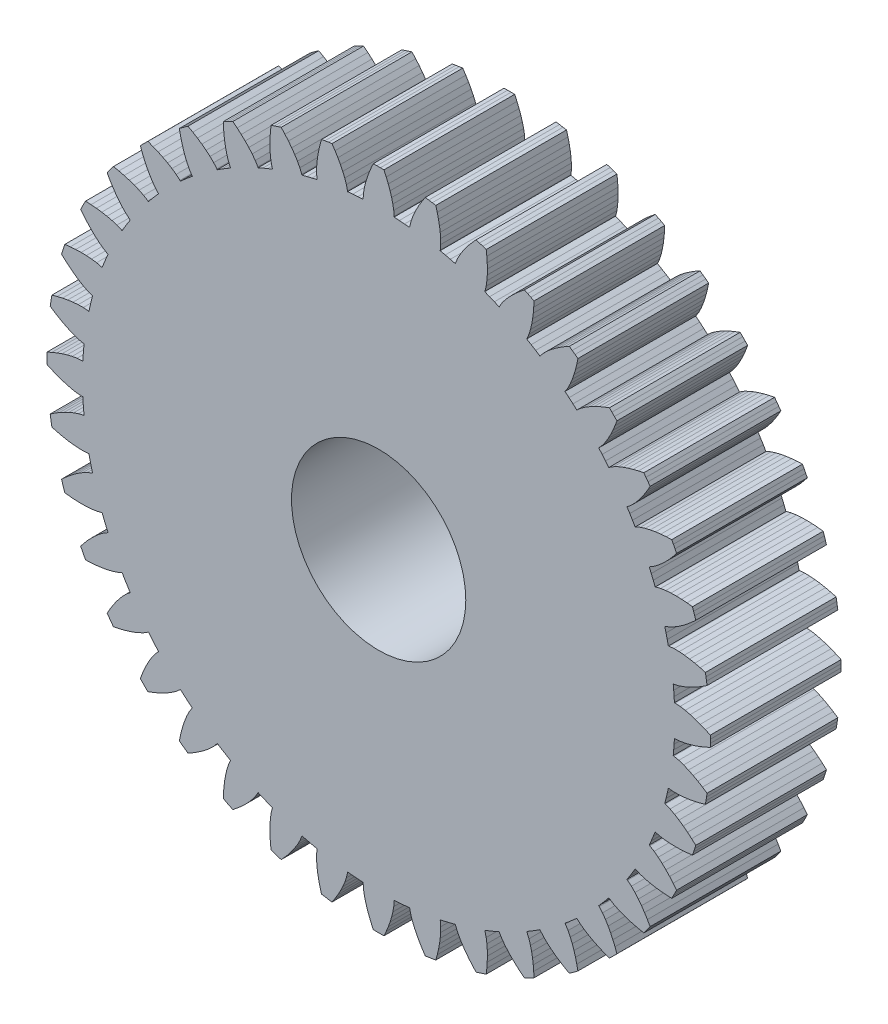
from build123d import *

# Parameters (mm, degrees)
PLANET_TEETH_START = 31
SKETCH_1_R         = 8
PLANET_TEETH_DEPTH = 12


with BuildPart() as part:
    # Эскиз1 → Planet_teeth (new body)
    with BuildSketch(Plane.XY.offset(PLANET_TEETH_START)):
        Polygon((27.150601793, -1.415972642), (27.214101499, -1.419284313), (27.673344407, -1.386851973), (28.134747978, -1.306384927), (28.597168009, -1.193180239), (29.059986965, -1.052398323), (29.522706251, -0.886883962), (29.9848782, -0.698473564), (30.446081949, -0.488460798), (30.449564653, -0.162826474), (30.449564653, 0.162826474), (30.446081949, 0.488460798), (29.9848782, 0.698473564), (29.522706251, 0.886883962), (29.059986965, 1.052398323), (28.597168009, 1.193180239), (28.134747978, 1.306384927), (27.673344407, 1.386851973), (27.214101499, 1.419284313), (27.150601793, 1.415972642), (27.121433438, 1.894202874), (27.0838422, 2.371844838), (27.037839754, 2.848750198), (27.101075732, 2.855412842), (27.549591063, 2.959287304), (27.992726171, 3.110943089), (28.431743929, 3.295092469), (28.866841671, 3.506541961), (29.297971965, 3.74240381), (29.724979931, 4.000794185), (30.147652261, 4.280369508), (30.100151656, 4.602539548), (30.049208311, 4.924183167), (29.994828054, 5.245263577), (29.506449254, 5.380542576), (29.020493529, 5.494333707), (28.537578934, 5.585425068), (28.058434904, 5.652072889), (27.583998917, 5.691545409), (27.11568817, 5.698842352), (26.657025768, 5.659033977), (26.594825908, 5.645829537), (26.491204974, 6.113609024), (26.379356881, 6.579489858), (26.259316367, 7.043327353), (26.320731538, 7.059800255), (26.747475355, 7.232559107), (27.161430543, 7.451669361), (27.566235954, 7.702229065), (27.962898933, 7.979139545), (28.351824375, 8.27954118), (28.733154004, 8.601549104), (29.106887321, 8.94380291), (29.009573029, 9.25457577), (28.908940734, 9.564290128), (28.805001946, 9.872910559), (28.301473601, 9.930124773), (27.803699942, 9.966494723), (27.312480999, 9.980920111), (26.828810012, 9.971792747), (26.354040256, 9.936561155), (25.890353698, 9.870508319), (25.443565593, 9.759439444), (25.384197147, 9.73666737), (25.208675124, 10.18247783), (25.025324248, 10.625126001), (24.834201461, 11.064474414), (24.89228358, 11.090351957), (25.286748033, 11.327741301), (25.661330351, 11.608910802), (26.021955762, 11.919711219), (26.370416819, 12.255264233), (26.707560774, 12.612808768), (27.033822466, 12.990505336), (27.349414214, 13.387010202), (27.204682436, 13.678733623), (27.056839092, 13.968892524), (26.905901091, 14.257453717), (26.399621741, 14.235194341), (25.902286988, 14.193247561), (25.414859138, 14.130651776), (24.938570777, 14.045973973), (24.47515766, 13.936905787), (24.027512793, 13.799129613), (23.603600391, 13.619535122), (23.548525206, 13.587756139), (23.305424029, 14.000620239), (23.055085077, 14.40913628), (22.797586095, 14.813177394), (22.850904987, 14.847822386), (23.203377054, 15.143996909), (23.529363041, 15.480302332), (23.836928658, 15.843690523), (24.128607524, 16.229623641), (24.40566839, 16.635507145), (24.668828498, 17.059592214), (24.918507762, 17.500584873), (24.729922275, 17.766075657), (24.538508275, 18.029534426), (24.344287656, 18.290931046), (23.847723578, 18.189746181), (23.363073764, 18.070515539), (22.891439097, 17.932439898), (22.434261163, 17.774296703), (21.993615453, 17.594077546), (21.57303478, 17.387970539), (21.182436211, 17.144272644), (21.133010421, 17.104269256), (20.828316049, 17.474020911), (20.517153196, 17.838345802), (20.199618499, 18.197130784), (20.246861276, 18.239690151), (20.548661923, 18.587357054), (20.818024723, 18.970517442), (21.06495726, 19.377545584), (21.292671835, 19.804355853), (21.502827452, 20.248584125), (21.696406102, 20.708615315), (21.874024949, 21.183237064), (21.646229354, 21.415957946), (21.415957946, 21.646229354), (21.183237064, 21.874024949), (20.708615315, 21.696406102), (20.248584125, 21.502827452), (19.804355853, 21.292671835), (19.377545584, 21.06495726), (18.970517442, 20.818024723), (18.587357054, 20.548661923), (18.239690151, 20.246861276), (18.197130784, 20.199618499), (17.838345802, 20.517153196), (17.474020911, 20.828316049), (17.104269256, 21.133010421), (17.144272644, 21.182436211), (17.387970539, 21.57303478), (17.594077546, 21.993615453), (17.774296703, 22.434261163), (17.932439898, 22.891439097), (18.070515539, 23.363073764), (18.189746181, 23.847723578), (18.290931046, 24.344287656), (18.029534426, 24.538508275), (17.766075657, 24.729922275), (17.500584873, 24.918507762), (17.059592214, 24.668828498), (16.635507145, 24.40566839), (16.229623641, 24.128607524), (15.843690523, 23.836928658), (15.480302332, 23.529363041), (15.143996909, 23.203377054), (14.847822386, 22.850904987), (14.813177394, 22.797586095), (14.40913628, 23.055085077), (14.000620239, 23.305424029), (13.587756139, 23.548525206), (13.619535122, 23.603600391), (13.799129613, 24.027512793), (13.936905787, 24.47515766), (14.045973973, 24.938570777), (14.130651776, 25.414859138), (14.193247561, 25.902286988), (14.235194341, 26.399621741), (14.257453717, 26.905901091), (13.968892524, 27.056839092), (13.678733623, 27.204682436), (13.387010202, 27.349414214), (12.990505336, 27.033822466), (12.612808768, 26.707560774), (12.255264233, 26.370416819), (11.919711219, 26.021955762), (11.608910802, 25.661330351), (11.327741301, 25.286748033), (11.090351957, 24.89228358), (11.064474414, 24.834201461), (10.625126001, 25.025324248), (10.18247783, 25.208675124), (9.73666737, 25.384197147), (9.759439444, 25.443565593), (9.870508319, 25.890353698), (9.936561155, 26.354040256), (9.971792747, 26.828810012), (9.980920111, 27.312480999), (9.966494723, 27.803699942), (9.930124773, 28.301473601), (9.872910559, 28.805001946), (9.564290128, 28.908940734), (9.25457577, 29.009573029), (8.94380291, 29.106887321), (8.601549104, 28.733154004), (8.27954118, 28.351824375), (7.979139545, 27.962898933), (7.702229065, 27.566235954), (7.451669361, 27.161430543), (7.232559107, 26.747475355), (7.059800255, 26.320731538), (7.043327353, 26.259316367), (6.579489858, 26.379356881), (6.113609024, 26.491204974), (5.645829537, 26.594825908), (5.659033977, 26.657025768), (5.698842352, 27.11568817), (5.691545409, 27.583998917), (5.652072889, 28.058434904), (5.585425068, 28.537578934), (5.494333707, 29.020493529), (5.380542576, 29.506449254), (5.245263577, 29.994828054), (4.924183167, 30.049208311), (4.602539548, 30.100151656), (4.280369508, 30.147652261), (4.000794185, 29.724979931), (3.74240381, 29.297971965), (3.506541961, 28.866841671), (3.295092469, 28.431743929), (3.110943089, 27.992726171), (2.959287304, 27.549591063), (2.855412842, 27.101075732), (2.848750198, 27.037839754), (2.371844838, 27.0838422), (1.894202874, 27.121433438), (1.415972642, 27.150601793), (1.419284313, 27.214101499), (1.386851973, 27.673344407), (1.306384927, 28.134747978), (1.193180239, 28.597168009), (1.052398323, 29.059986965), (0.886883962, 29.522706251), (0.698473564, 29.9848782), (0.488460798, 30.446081949), (0.162826474, 30.449564653), (-0.162826474, 30.449564653), (-0.488460798, 30.446081949), (-0.698473564, 29.9848782), (-0.886883962, 29.522706251), (-1.052398323, 29.059986965), (-1.193180239, 28.597168009), (-1.306384927, 28.134747978), (-1.386851973, 27.673344407), (-1.419284313, 27.214101499), (-1.415972642, 27.150601793), (-1.894202874, 27.121433438), (-2.371844838, 27.0838422), (-2.848750198, 27.037839754), (-2.855412842, 27.101075732), (-2.959287304, 27.549591063), (-3.110943089, 27.992726171), (-3.295092469, 28.431743929), (-3.506541961, 28.866841671), (-3.74240381, 29.297971965), (-4.000794185, 29.724979931), (-4.280369508, 30.147652261), (-4.602539548, 30.100151656), (-4.924183167, 30.049208311), (-5.245263577, 29.994828054), (-5.380542576, 29.506449254), (-5.494333707, 29.020493529), (-5.585425068, 28.537578934), (-5.652072889, 28.058434904), (-5.691545409, 27.583998917), (-5.698842352, 27.11568817), (-5.659033977, 26.657025768), (-5.645829537, 26.594825908), (-6.113609024, 26.491204974), (-6.579489858, 26.379356881), (-7.043327353, 26.259316367), (-7.059800255, 26.320731538), (-7.232559107, 26.747475355), (-7.451669361, 27.161430543), (-7.702229065, 27.566235954), (-7.979139545, 27.962898933), (-8.27954118, 28.351824375), (-8.601549104, 28.733154004), (-8.94380291, 29.106887321), (-9.25457577, 29.009573029), (-9.564290128, 28.908940734), (-9.872910559, 28.805001946), (-9.930124773, 28.301473601), (-9.966494723, 27.803699942), (-9.980920111, 27.312480999), (-9.971792747, 26.828810012), (-9.936561155, 26.354040256), (-9.870508319, 25.890353698), (-9.759439444, 25.443565593), (-9.73666737, 25.384197147), (-10.18247783, 25.208675124), (-10.625126001, 25.025324248), (-11.064474414, 24.834201461), (-11.090351957, 24.89228358), (-11.327741301, 25.286748033), (-11.608910802, 25.661330351), (-11.919711219, 26.021955762), (-12.255264233, 26.370416819), (-12.612808768, 26.707560774), (-12.990505336, 27.033822466), (-13.387010202, 27.349414214), (-13.678733623, 27.204682436), (-13.968892524, 27.056839092), (-14.257453717, 26.905901091), (-14.235194341, 26.399621741), (-14.193247561, 25.902286988), (-14.130651776, 25.414859138), (-14.045973973, 24.938570777), (-13.936905787, 24.47515766), (-13.799129613, 24.027512793), (-13.619535122, 23.603600391), (-13.587756139, 23.548525206), (-14.000620239, 23.305424029), (-14.40913628, 23.055085077), (-14.813177394, 22.797586095), (-14.847822386, 22.850904987), (-15.143996909, 23.203377054), (-15.480302332, 23.529363041), (-15.843690523, 23.836928658), (-16.229623641, 24.128607524), (-16.635507145, 24.40566839), (-17.059592214, 24.668828498), (-17.500584873, 24.918507762), (-17.766075657, 24.729922275), (-18.029534426, 24.538508275), (-18.290931046, 24.344287656), (-18.189746181, 23.847723578), (-18.070515539, 23.363073764), (-17.932439898, 22.891439097), (-17.774296703, 22.434261163), (-17.594077546, 21.993615453), (-17.387970539, 21.57303478), (-17.144272644, 21.182436211), (-17.104269256, 21.133010421), (-17.474020911, 20.828316049), (-17.838345802, 20.517153196), (-18.197130784, 20.199618499), (-18.239690151, 20.246861276), (-18.587357054, 20.548661923), (-18.970517442, 20.818024723), (-19.377545584, 21.06495726), (-19.804355853, 21.292671835), (-20.248584125, 21.502827452), (-20.708615315, 21.696406102), (-21.183237064, 21.874024949), (-21.415957946, 21.646229354), (-21.646229354, 21.415957946), (-21.874024949, 21.183237064), (-21.696406102, 20.708615315), (-21.502827452, 20.248584125), (-21.292671835, 19.804355853), (-21.06495726, 19.377545584), (-20.818024723, 18.970517442), (-20.548661923, 18.587357054), (-20.246861276, 18.239690151), (-20.199618499, 18.197130784), (-20.517153196, 17.838345802), (-20.828316049, 17.474020911), (-21.133010421, 17.104269256), (-21.182436211, 17.144272644), (-21.57303478, 17.387970539), (-21.993615453, 17.594077546), (-22.434261163, 17.774296703), (-22.891439097, 17.932439898), (-23.363073764, 18.070515539), (-23.847723578, 18.189746181), (-24.344287656, 18.290931046), (-24.538508275, 18.029534426), (-24.729922275, 17.766075657), (-24.918507762, 17.500584873), (-24.668828498, 17.059592214), (-24.40566839, 16.635507145), (-24.128607524, 16.229623641), (-23.836928658, 15.843690523), (-23.529363041, 15.480302332), (-23.203377054, 15.143996909), (-22.850904987, 14.847822386), (-22.797586095, 14.813177394), (-23.055085077, 14.40913628), (-23.305424029, 14.000620239), (-23.548525206, 13.587756139), (-23.603600391, 13.619535122), (-24.027512793, 13.799129613), (-24.47515766, 13.936905787), (-24.938570777, 14.045973973), (-25.414859138, 14.130651776), (-25.902286988, 14.193247561), (-26.399621741, 14.235194341), (-26.905901091, 14.257453717), (-27.056839092, 13.968892524), (-27.204682436, 13.678733623), (-27.349414214, 13.387010202), (-27.033822466, 12.990505336), (-26.707560774, 12.612808768), (-26.370416819, 12.255264233), (-26.021955762, 11.919711219), (-25.661330351, 11.608910802), (-25.286748033, 11.327741301), (-24.89228358, 11.090351957), (-24.834201461, 11.064474414), (-25.025324248, 10.625126001), (-25.208675124, 10.18247783), (-25.384197147, 9.73666737), (-25.443565593, 9.759439444), (-25.890353698, 9.870508319), (-26.354040256, 9.936561155), (-26.828810012, 9.971792747), (-27.312480999, 9.980920111), (-27.803699942, 9.966494723), (-28.301473601, 9.930124773), (-28.805001946, 9.872910559), (-28.908940734, 9.564290128), (-29.009573029, 9.25457577), (-29.106887321, 8.94380291), (-28.733154004, 8.601549104), (-28.351824375, 8.27954118), (-27.962898933, 7.979139545), (-27.566235954, 7.702229065), (-27.161430543, 7.451669361), (-26.747475355, 7.232559107), (-26.320731538, 7.059800255), (-26.259316367, 7.043327353), (-26.379356881, 6.579489858), (-26.491204974, 6.113609024), (-26.594825908, 5.645829537), (-26.657025768, 5.659033977), (-27.11568817, 5.698842352), (-27.583998917, 5.691545409), (-28.058434904, 5.652072889), (-28.537578934, 5.585425068), (-29.020493529, 5.494333707), (-29.506449254, 5.380542576), (-29.994828054, 5.245263577), (-30.049208311, 4.924183167), (-30.100151656, 4.602539548), (-30.147652261, 4.280369508), (-29.724979931, 4.000794185), (-29.297971965, 3.74240381), (-28.866841671, 3.506541961), (-28.431743929, 3.295092469), (-27.992726171, 3.110943089), (-27.549591063, 2.959287304), (-27.101075732, 2.855412842), (-27.037839754, 2.848750198), (-27.0838422, 2.371844838), (-27.121433438, 1.894202874), (-27.150601793, 1.415972642), (-27.214101499, 1.419284313), (-27.673344407, 1.386851973), (-28.134747978, 1.306384927), (-28.597168009, 1.193180239), (-29.059986965, 1.052398323), (-29.522706251, 0.886883962), (-29.9848782, 0.698473564), (-30.446081949, 0.488460798), (-30.449564653, 0.162826474), (-30.449564653, -0.162826474), (-30.446081949, -0.488460798), (-29.9848782, -0.698473564), (-29.522706251, -0.886883962), (-29.059986965, -1.052398323), (-28.597168009, -1.193180239), (-28.134747978, -1.306384927), (-27.673344407, -1.386851973), (-27.214101499, -1.419284313), (-27.150601793, -1.415972642), (-27.121433438, -1.894202874), (-27.0838422, -2.371844838), (-27.037839754, -2.848750198), (-27.101075732, -2.855412842), (-27.549591063, -2.959287304), (-27.992726171, -3.110943089), (-28.431743929, -3.295092469), (-28.866841671, -3.506541961), (-29.297971965, -3.74240381), (-29.724979931, -4.000794185), (-30.147652261, -4.280369508), (-30.100151656, -4.602539548), (-30.049208311, -4.924183167), (-29.994828054, -5.245263577), (-29.506449254, -5.380542576), (-29.020493529, -5.494333707), (-28.537578934, -5.585425068), (-28.058434904, -5.652072889), (-27.583998917, -5.691545409), (-27.11568817, -5.698842352), (-26.657025768, -5.659033977), (-26.594825908, -5.645829537), (-26.491204974, -6.113609024), (-26.379356881, -6.579489858), (-26.259316367, -7.043327353), (-26.320731538, -7.059800255), (-26.747475355, -7.232559107), (-27.161430543, -7.451669361), (-27.566235954, -7.702229065), (-27.962898933, -7.979139545), (-28.351824375, -8.27954118), (-28.733154004, -8.601549104), (-29.106887321, -8.94380291), (-29.009573029, -9.25457577), (-28.908940734, -9.564290128), (-28.805001946, -9.872910559), (-28.301473601, -9.930124773), (-27.803699942, -9.966494723), (-27.312480999, -9.980920111), (-26.828810012, -9.971792747), (-26.354040256, -9.936561155), (-25.890353698, -9.870508319), (-25.443565593, -9.759439444), (-25.384197147, -9.73666737), (-25.208675124, -10.18247783), (-25.025324248, -10.625126001), (-24.834201461, -11.064474414), (-24.89228358, -11.090351957), (-25.286748033, -11.327741301), (-25.661330351, -11.608910802), (-26.021955762, -11.919711219), (-26.370416819, -12.255264233), (-26.707560774, -12.612808768), (-27.033822466, -12.990505336), (-27.349414214, -13.387010202), (-27.204682436, -13.678733623), (-27.056839092, -13.968892524), (-26.905901091, -14.257453717), (-26.399621741, -14.235194341), (-25.902286988, -14.193247561), (-25.414859138, -14.130651776), (-24.938570777, -14.045973973), (-24.47515766, -13.936905787), (-24.027512793, -13.799129613), (-23.603600391, -13.619535122), (-23.548525206, -13.587756139), (-23.305424029, -14.000620239), (-23.055085077, -14.40913628), (-22.797586095, -14.813177394), (-22.850904987, -14.847822386), (-23.203377054, -15.143996909), (-23.529363041, -15.480302332), (-23.836928658, -15.843690523), (-24.128607524, -16.229623641), (-24.40566839, -16.635507145), (-24.668828498, -17.059592214), (-24.918507762, -17.500584873), (-24.729922275, -17.766075657), (-24.538508275, -18.029534426), (-24.344287656, -18.290931046), (-23.847723578, -18.189746181), (-23.363073764, -18.070515539), (-22.891439097, -17.932439898), (-22.434261163, -17.774296703), (-21.993615453, -17.594077546), (-21.57303478, -17.387970539), (-21.182436211, -17.144272644), (-21.133010421, -17.104269256), (-20.828316049, -17.474020911), (-20.517153196, -17.838345802), (-20.199618499, -18.197130784), (-20.246861276, -18.239690151), (-20.548661923, -18.587357054), (-20.818024723, -18.970517442), (-21.06495726, -19.377545584), (-21.292671835, -19.804355853), (-21.502827452, -20.248584125), (-21.696406102, -20.708615315), (-21.874024949, -21.183237064), (-21.646229354, -21.415957946), (-21.415957946, -21.646229354), (-21.183237064, -21.874024949), (-20.708615315, -21.696406102), (-20.248584125, -21.502827452), (-19.804355853, -21.292671835), (-19.377545584, -21.06495726), (-18.970517442, -20.818024723), (-18.587357054, -20.548661923), (-18.239690151, -20.246861276), (-18.197130784, -20.199618499), (-17.838345802, -20.517153196), (-17.474020911, -20.828316049), (-17.104269256, -21.133010421), (-17.144272644, -21.182436211), (-17.387970539, -21.57303478), (-17.594077546, -21.993615453), (-17.774296703, -22.434261163), (-17.932439898, -22.891439097), (-18.070515539, -23.363073764), (-18.189746181, -23.847723578), (-18.290931046, -24.344287656), (-18.029534426, -24.538508275), (-17.766075657, -24.729922275), (-17.500584873, -24.918507762), (-17.059592214, -24.668828498), (-16.635507145, -24.40566839), (-16.229623641, -24.128607524), (-15.843690523, -23.836928658), (-15.480302332, -23.529363041), (-15.143996909, -23.203377054), (-14.847822386, -22.850904987), (-14.813177394, -22.797586095), (-14.40913628, -23.055085077), (-14.000620239, -23.305424029), (-13.587756139, -23.548525206), (-13.619535122, -23.603600391), (-13.799129613, -24.027512793), (-13.936905787, -24.47515766), (-14.045973973, -24.938570777), (-14.130651776, -25.414859138), (-14.193247561, -25.902286988), (-14.235194341, -26.399621741), (-14.257453717, -26.905901091), (-13.968892524, -27.056839092), (-13.678733623, -27.204682436), (-13.387010202, -27.349414214), (-12.990505336, -27.033822466), (-12.612808768, -26.707560774), (-12.255264233, -26.370416819), (-11.919711219, -26.021955762), (-11.608910802, -25.661330351), (-11.327741301, -25.286748033), (-11.090351957, -24.89228358), (-11.064474414, -24.834201461), (-10.625126001, -25.025324248), (-10.18247783, -25.208675124), (-9.73666737, -25.384197147), (-9.759439444, -25.443565593), (-9.870508319, -25.890353698), (-9.936561155, -26.354040256), (-9.971792747, -26.828810012), (-9.980920111, -27.312480999), (-9.966494723, -27.803699942), (-9.930124773, -28.301473601), (-9.872910559, -28.805001946), (-9.564290128, -28.908940734), (-9.25457577, -29.009573029), (-8.94380291, -29.106887321), (-8.601549104, -28.733154004), (-8.27954118, -28.351824375), (-7.979139545, -27.962898933), (-7.702229065, -27.566235954), (-7.451669361, -27.161430543), (-7.232559107, -26.747475355), (-7.059800255, -26.320731538), (-7.043327353, -26.259316367), (-6.579489858, -26.379356881), (-6.113609024, -26.491204974), (-5.645829537, -26.594825908), (-5.659033977, -26.657025768), (-5.698842352, -27.11568817), (-5.691545409, -27.583998917), (-5.652072889, -28.058434904), (-5.585425068, -28.537578934), (-5.494333707, -29.020493529), (-5.380542576, -29.506449254), (-5.245263577, -29.994828054), (-4.924183167, -30.049208311), (-4.602539548, -30.100151656), (-4.280369508, -30.147652261), (-4.000794185, -29.724979931), (-3.74240381, -29.297971965), (-3.506541961, -28.866841671), (-3.295092469, -28.431743929), (-3.110943089, -27.992726171), (-2.959287304, -27.549591063), (-2.855412842, -27.101075732), (-2.848750198, -27.037839754), (-2.371844838, -27.0838422), (-1.894202874, -27.121433438), (-1.415972642, -27.150601793), (-1.419284313, -27.214101499), (-1.386851973, -27.673344407), (-1.306384927, -28.134747978), (-1.193180239, -28.597168009), (-1.052398323, -29.059986965), (-0.886883962, -29.522706251), (-0.698473564, -29.9848782), (-0.488460798, -30.446081949), (-0.162826474, -30.449564653), (0.162826474, -30.449564653), (0.488460798, -30.446081949), (0.698473564, -29.9848782), (0.886883962, -29.522706251), (1.052398323, -29.059986965), (1.193180239, -28.597168009), (1.306384927, -28.134747978), (1.386851973, -27.673344407), (1.419284313, -27.214101499), (1.415972642, -27.150601793), (1.894202874, -27.121433438), (2.371844838, -27.0838422), (2.848750198, -27.037839754), (2.855412842, -27.101075732), (2.959287304, -27.549591063), (3.110943089, -27.992726171), (3.295092469, -28.431743929), (3.506541961, -28.866841671), (3.74240381, -29.297971965), (4.000794185, -29.724979931), (4.280369508, -30.147652261), (4.602539548, -30.100151656), (4.924183167, -30.049208311), (5.245263577, -29.994828054), (5.380542576, -29.506449254), (5.494333707, -29.020493529), (5.585425068, -28.537578934), (5.652072889, -28.058434904), (5.691545409, -27.583998917), (5.698842352, -27.11568817), (5.659033977, -26.657025768), (5.645829537, -26.594825908), (6.113609024, -26.491204974), (6.579489858, -26.379356881), (7.043327353, -26.259316367), (7.059800255, -26.320731538), (7.232559107, -26.747475355), (7.451669361, -27.161430543), (7.702229065, -27.566235954), (7.979139545, -27.962898933), (8.27954118, -28.351824375), (8.601549104, -28.733154004), (8.94380291, -29.106887321), (9.25457577, -29.009573029), (9.564290128, -28.908940734), (9.872910559, -28.805001946), (9.930124773, -28.301473601), (9.966494723, -27.803699942), (9.980920111, -27.312480999), (9.971792747, -26.828810012), (9.936561155, -26.354040256), (9.870508319, -25.890353698), (9.759439444, -25.443565593), (9.73666737, -25.384197147), (10.18247783, -25.208675124), (10.625126001, -25.025324248), (11.064474414, -24.834201461), (11.090351957, -24.89228358), (11.327741301, -25.286748033), (11.608910802, -25.661330351), (11.919711219, -26.021955762), (12.255264233, -26.370416819), (12.612808768, -26.707560774), (12.990505336, -27.033822466), (13.387010202, -27.349414214), (13.678733623, -27.204682436), (13.968892524, -27.056839092), (14.257453717, -26.905901091), (14.235194341, -26.399621741), (14.193247561, -25.902286988), (14.130651776, -25.414859138), (14.045973973, -24.938570777), (13.936905787, -24.47515766), (13.799129613, -24.027512793), (13.619535122, -23.603600391), (13.587756139, -23.548525206), (14.000620239, -23.305424029), (14.40913628, -23.055085077), (14.813177394, -22.797586095), (14.847822386, -22.850904987), (15.143996909, -23.203377054), (15.480302332, -23.529363041), (15.843690523, -23.836928658), (16.229623641, -24.128607524), (16.635507145, -24.40566839), (17.059592214, -24.668828498), (17.500584873, -24.918507762), (17.766075657, -24.729922275), (18.029534426, -24.538508275), (18.290931046, -24.344287656), (18.189746181, -23.847723578), (18.070515539, -23.363073764), (17.932439898, -22.891439097), (17.774296703, -22.434261163), (17.594077546, -21.993615453), (17.387970539, -21.57303478), (17.144272644, -21.182436211), (17.104269256, -21.133010421), (17.474020911, -20.828316049), (17.838345802, -20.517153196), (18.197130784, -20.199618499), (18.239690151, -20.246861276), (18.587357054, -20.548661923), (18.970517442, -20.818024723), (19.377545584, -21.06495726), (19.804355853, -21.292671835), (20.248584125, -21.502827452), (20.708615315, -21.696406102), (21.183237064, -21.874024949), (21.415957946, -21.646229354), (21.646229354, -21.415957946), (21.874024949, -21.183237064), (21.696406102, -20.708615315), (21.502827452, -20.248584125), (21.292671835, -19.804355853), (21.06495726, -19.377545584), (20.818024723, -18.970517442), (20.548661923, -18.587357054), (20.246861276, -18.239690151), (20.199618499, -18.197130784), (20.517153196, -17.838345802), (20.828316049, -17.474020911), (21.133010421, -17.104269256), (21.182436211, -17.144272644), (21.57303478, -17.387970539), (21.993615453, -17.594077546), (22.434261163, -17.774296703), (22.891439097, -17.932439898), (23.363073764, -18.070515539), (23.847723578, -18.189746181), (24.344287656, -18.290931046), (24.538508275, -18.029534426), (24.729922275, -17.766075657), (24.918507762, -17.500584873), (24.668828498, -17.059592214), (24.40566839, -16.635507145), (24.128607524, -16.229623641), (23.836928658, -15.843690523), (23.529363041, -15.480302332), (23.203377054, -15.143996909), (22.850904987, -14.847822386), (22.797586095, -14.813177394), (23.055085077, -14.40913628), (23.305424029, -14.000620239), (23.548525206, -13.587756139), (23.603600391, -13.619535122), (24.027512793, -13.799129613), (24.47515766, -13.936905787), (24.938570777, -14.045973973), (25.414859138, -14.130651776), (25.902286988, -14.193247561), (26.399621741, -14.235194341), (26.905901091, -14.257453717), (27.056839092, -13.968892524), (27.204682436, -13.678733623), (27.349414214, -13.387010202), (27.033822466, -12.990505336), (26.707560774, -12.612808768), (26.370416819, -12.255264233), (26.021955762, -11.919711219), (25.661330351, -11.608910802), (25.286748033, -11.327741301), (24.89228358, -11.090351957), (24.834201461, -11.064474414), (25.025324248, -10.625126001), (25.208675124, -10.18247783), (25.384197147, -9.73666737), (25.443565593, -9.759439444), (25.890353698, -9.870508319), (26.354040256, -9.936561155), (26.828810012, -9.971792747), (27.312480999, -9.980920111), (27.803699942, -9.966494723), (28.301473601, -9.930124773), (28.805001946, -9.872910559), (28.908940734, -9.564290128), (29.009573029, -9.25457577), (29.106887321, -8.94380291), (28.733154004, -8.601549104), (28.351824375, -8.27954118), (27.962898933, -7.979139545), (27.566235954, -7.702229065), (27.161430543, -7.451669361), (26.747475355, -7.232559107), (26.320731538, -7.059800255), (26.259316367, -7.043327353), (26.379356881, -6.579489858), (26.491204974, -6.113609024), (26.594825908, -5.645829537), (26.657025768, -5.659033977), (27.11568817, -5.698842352), (27.583998917, -5.691545409), (28.058434904, -5.652072889), (28.537578934, -5.585425068), (29.020493529, -5.494333707), (29.506449254, -5.380542576), (29.994828054, -5.245263577), (30.049208311, -4.924183167), (30.100151656, -4.602539548), (30.147652261, -4.280369508), (29.724979931, -4.000794185), (29.297971965, -3.74240381), (28.866841671, -3.506541961), (28.431743929, -3.295092469), (27.992726171, -3.110943089), (27.549591063, -2.959287304), (27.101075732, -2.855412842), (27.037839754, -2.848750198), (27.0838422, -2.371844838), (27.121433438, -1.894202874), align=None)
        Circle(SKETCH_1_R, mode=Mode.SUBTRACT)
    extrude(amount=PLANET_TEETH_DEPTH)


solid = part.part
